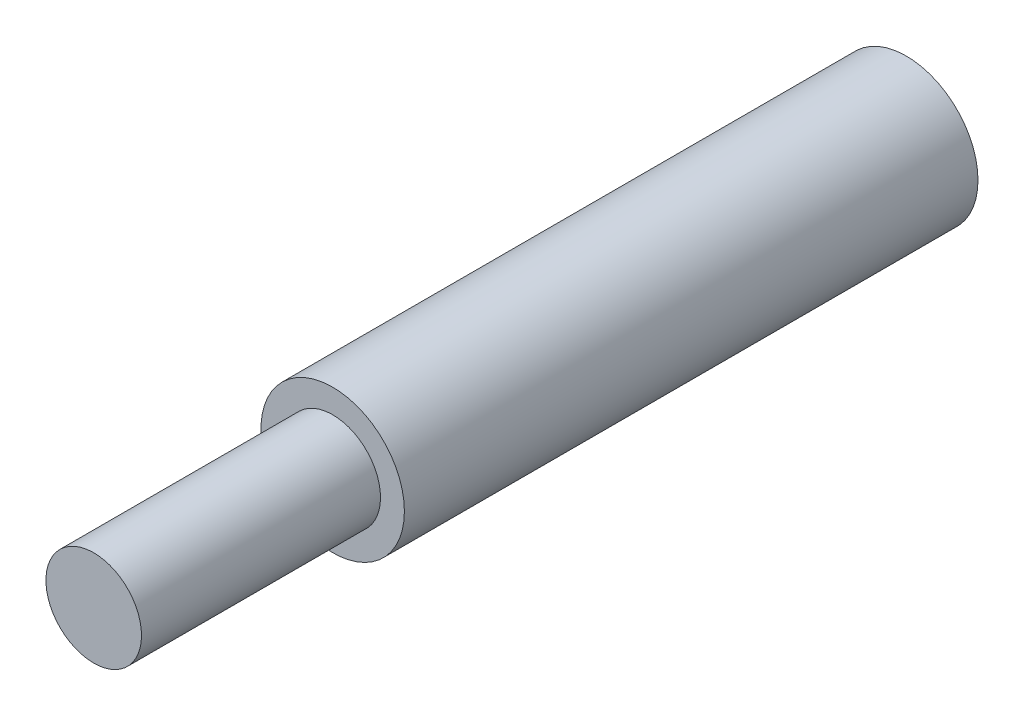
from build123d import *

# Parameters (mm, degrees)
SMOOTH_STOP_SHANK_D6_L24_START   = -24
SKETCH1_R                        = 3
SMOOTH_STOP_SHANK_D6_L24_DEPTH   = 24
SKETCH2_R                        = 2
M4X0P7_THREAD_ENVELOPE_L10_DEPTH = 10


with BuildPart() as part:
    # Sketch1 → Smooth_Stop_Shank_D6_L24 (new body)
    with BuildSketch(Plane.XY.offset(SMOOTH_STOP_SHANK_D6_L24_START)):
        Circle(SKETCH1_R)
    extrude(amount=SMOOTH_STOP_SHANK_D6_L24_DEPTH)

    # Sketch2 → M4x0p7_Thread_Envelope_L10 (add)
    with BuildSketch(Plane.XY):
        Circle(SKETCH2_R)
    extrude(amount=M4X0P7_THREAD_ENVELOPE_L10_DEPTH)


solid = part.part
